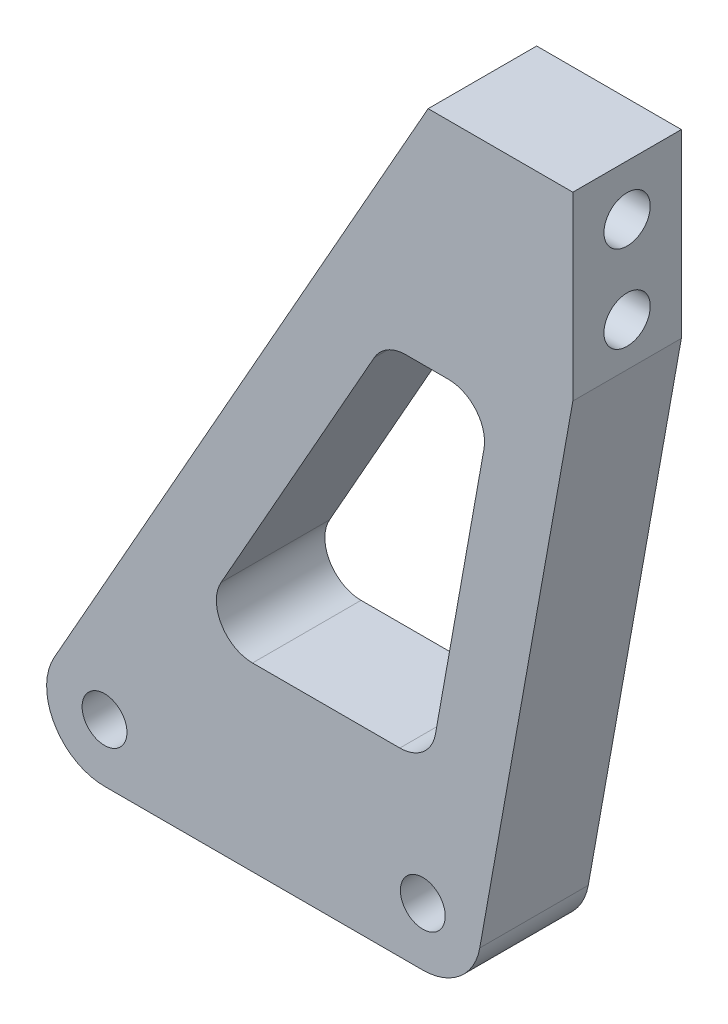
from build123d import *

# Parameters (mm, degrees)
BOSS_EXTRUDE1_DEPTH = 7.5
SKETCH2_R           = 1.55
CUT_EXTRUDE1_DEPTH  = 18.24093965
BOSS_EXTRUDE6_START = -7.5
BOSS_EXTRUDE6_DEPTH = 7.5
CUT_EXTRUDE2_REACH  = 62.49
SKETCH13_R          = 1.6
CUT_EXTRUDE8_DEPTH  = 53.848740761
FILLET1_R           = 2.5


with BuildPart() as part:
    # Sketch1 → Boss-Extrude1 (new body)
    with BuildSketch(Plane.XY):
        with BuildLine():
            Line((-11, 4), (11, 4))
            ThreePointArc((11, 4), (15, 0), (11, -4))
            Line((11, -4), (-11, -4))
            ThreePointArc((-11, -4), (-15, 0), (-11, 4))
        make_face()
    extrude(amount=BOSS_EXTRUDE1_DEPTH)

    # Sketch2 → Cut-Extrude1 (cut, through all)
    with BuildSketch(Plane.XY.offset(7.5)):
        with Locations((-11, 0)):
            Circle(SKETCH2_R)
    cut_extrude1 = extrude(amount=-CUT_EXTRUDE1_DEPTH, mode=Mode.SUBTRACT)

    # Mirror1: Cut-Extrude1 across plane
    add(cut_extrude1.mirror(Plane(origin=(0, 0, 0), x_dir=(0, 0, 1), z_dir=(1, 0, 0))), mode=Mode.SUBTRACT)

    # Sketch12 → Boss-Extrude6 (add)
    with BuildSketch(Plane.XY.offset(7.5).offset(BOSS_EXTRUDE6_START)):
        with BuildLine():
            Line((21.37, 35.25), (21.37, 47.75))
            Line((21.37, 47.75), (11.37, 47.75))
            Line((11.37, 47.75), (-14.48304631, 1.966821905))
            ThreePointArc((-14.48304631, 1.966821905), (-13.016520813, 3.454510647), (-11, 4))
            Line((-11, 4), (11, 4))
            ThreePointArc((11, 4), (14.067391334, 2.567315797), (14.937481114, -0.704444799))
            Line((14.937481114, -0.704444799), (21.37, 35.25))
        make_face()
    extrude(amount=BOSS_EXTRUDE6_DEPTH)

    # Cut-Extrude2: up to this plane
    cut_extrude2_end = Plane(origin=(-11.823529281, 6.676562501, -60.276646808), z_dir=(-0.870761577419204, 0.49170547616476634, 0))
    # Sketch13 → Cut-Extrude2 (cut, up to the surface)
    with BuildSketch(Plane(origin=(21.37, 0, 0), x_dir=(0, 0, -1), z_dir=(1, 0, 0)), mode=Mode.PRIVATE) as cut_extrude2_sk1:
        with Locations((-3.75, 38.25)):
            Circle(SKETCH13_R)
    cut_extrude2_tool1 = split(extrude(cut_extrude2_sk1.sketch, amount=-CUT_EXTRUDE2_REACH, mode=Mode.PRIVATE), bisect_by=cut_extrude2_end, keep=Keep.BOTH, mode=Mode.PRIVATE)
    add(cut_extrude2_tool1.solids().sort_by_distance((21.37, 38.25, 3.75))[0], mode=Mode.SUBTRACT)
    # Sketch13 → Cut-Extrude2 (cut, up to the surface)
    with BuildSketch(Plane(origin=(21.37, 0, 0), x_dir=(0, 0, -1), z_dir=(1, 0, 0)), mode=Mode.PRIVATE) as cut_extrude2_sk2:
        with Locations((-3.75, 44.25)):
            Circle(SKETCH13_R)
    cut_extrude2_tool2 = split(extrude(cut_extrude2_sk2.sketch, amount=-CUT_EXTRUDE2_REACH, mode=Mode.PRIVATE), bisect_by=cut_extrude2_end, keep=Keep.BOTH, mode=Mode.PRIVATE)
    add(cut_extrude2_tool2.solids().sort_by_distance((21.37, 44.25, 3.75))[0], mode=Mode.SUBTRACT)

    # Sketch15 → Cut-Extrude8 (cut, through all)
    with BuildSketch(Plane.XY.offset(7.5)):
        Polygon((15.753888137, 32.25), (8.359491787, 32.25), (-5.051762639, 8.5), (11.504835638, 8.5), align=None)
    extrude(amount=-CUT_EXTRUDE8_DEPTH, mode=Mode.SUBTRACT)

    # Fillet1
    fillet1_edges = [part.edges().sort_by_distance(p)[0] for p in [
        (8.359491787, 32.25, 3.75),
        (15.753888137, 32.25, 3.75),
        (11.504835638, 8.5, 3.75),
        (-5.051762639, 8.5, 3.75),
    ]]
    fillet(fillet1_edges, radius=FILLET1_R)


solid = part.part
